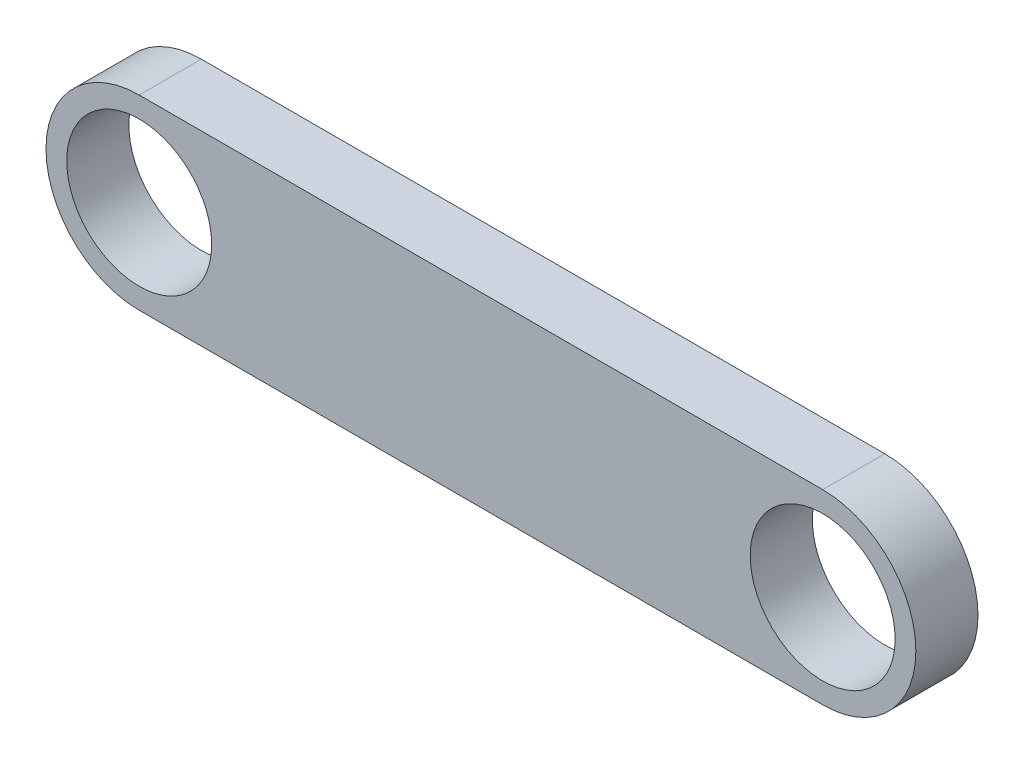
from build123d import *

# Parameters (mm, degrees)
SKETCH_1_R      = 3.5
EXTRUDE_1_DEPTH = 1.5


with BuildPart() as part:
    # 草图1 → 凸台-拉伸1 (new, symmetric)
    with BuildSketch(Plane.XY):
        with BuildLine():
            Line((33, 4.5), (0, 4.5))
            ThreePointArc((0, 4.5), (-4.5, 0), (0, -4.5))
            Line((0, -4.5), (33, -4.5))
            ThreePointArc((33, -4.5), (37.5, 0), (33, 4.5))
        make_face()
        with Locations((33, 0)):
            Circle(SKETCH_1_R, mode=Mode.SUBTRACT)
        Circle(SKETCH_1_R, mode=Mode.SUBTRACT)
    extrude(amount=EXTRUDE_1_DEPTH, both=True)


solid = part.part
